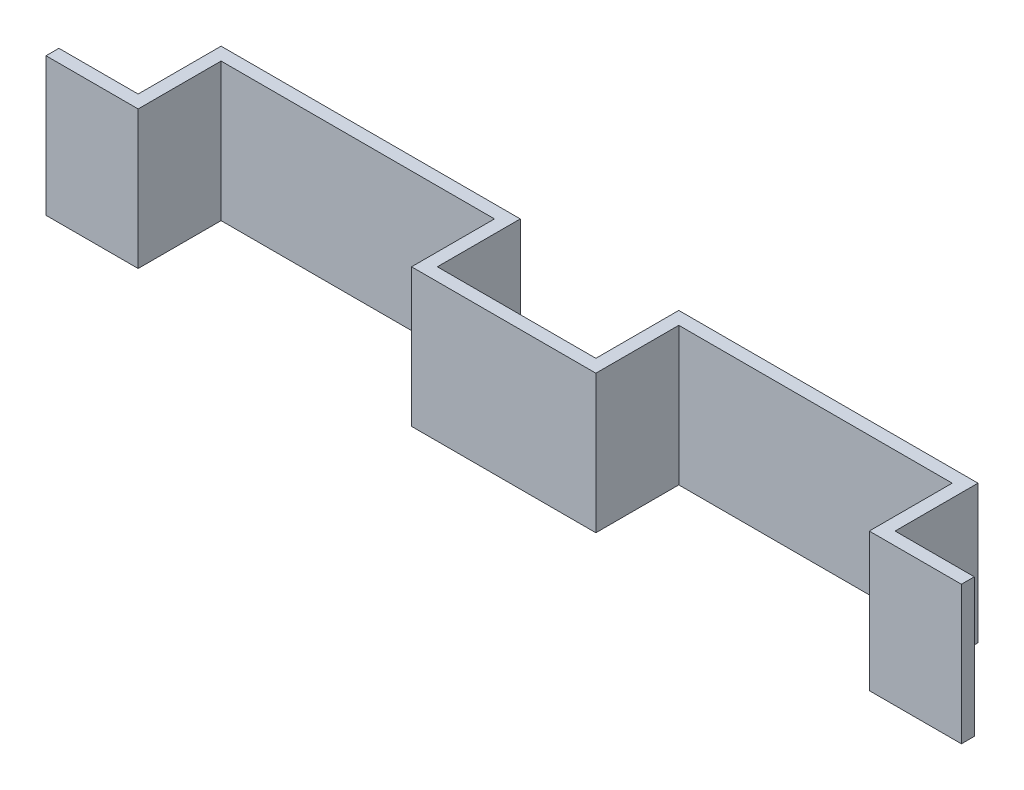
from build123d import *

# Parameters (mm, degrees)
BOSS_EXTRUDE2_DEPTH = 15


with BuildPart() as part:
    # Sketch1 → Boss-Extrude2 (new body)
    with BuildSketch(Plane(origin=(0, 0, 0), x_dir=(-1, 0, 0), z_dir=(0, 1, 0))):
        Polygon((0, 9), (0, 0), (32.47, 0), (32.47, 9), (49.67, 9), (49.67, 0), (82.14, 0), (82.14, 9), (90.74, 9), (90.74, 10.4), (80.74, 10.4), (80.74, 1.4), (51.07, 1.4), (51.07, 10.4), (31.07, 10.4), (31.07, 1.4), (1.4, 1.4), (1.4, 10.4), (-8.6, 10.4), (-8.6, 9), align=None)
    extrude(amount=BOSS_EXTRUDE2_DEPTH)


solid = part.part
